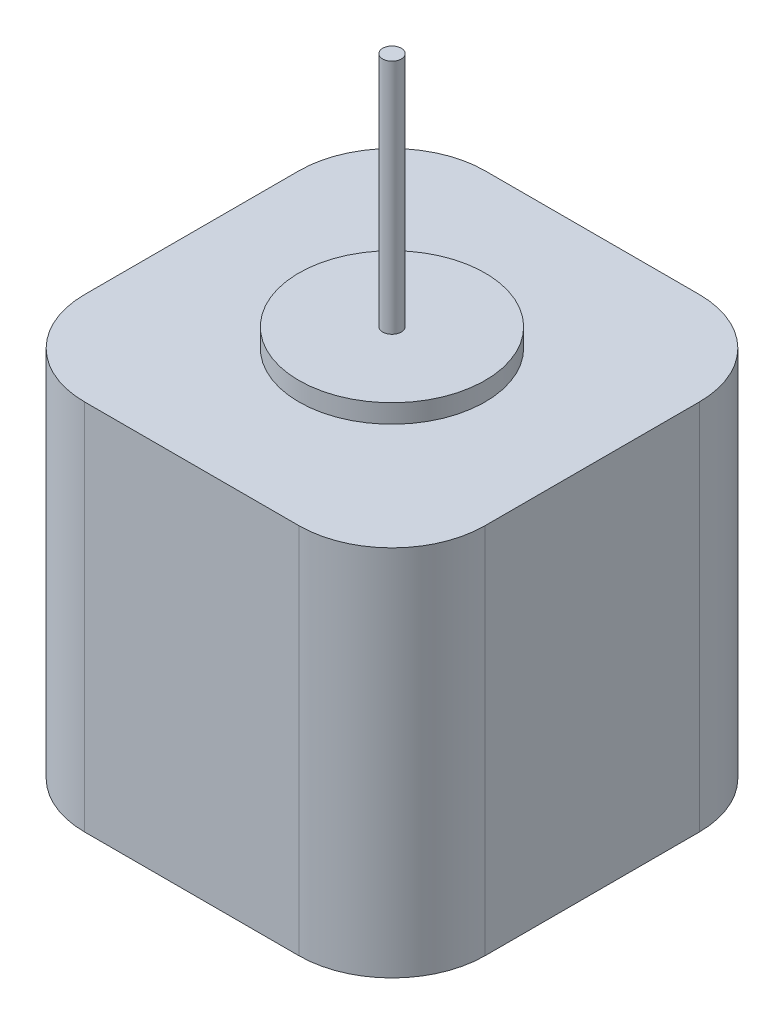
from build123d import *

# Parameters (mm, degrees)
BOSS_EXTRUDE1_DEPTH = 40
SKETCH2_R           = 10
BOSS_EXTRUDE2_DEPTH = 2
SKETCH3_R           = 1
BOSS_EXTRUDE3_DEPTH = 25.4


with BuildPart() as part:
    # Sketch1 → Boss-Extrude1 (new body)
    with BuildSketch(Plane(origin=(0, 0, 0), x_dir=(1, 0, 0), z_dir=(0, 1, 0))):
        with BuildLine():
            Line((11.5, 21.5), (-11.5, 21.5))
            ThreePointArc((-11.5, 21.5), (-18.571067812, 18.571067812), (-21.5, 11.5))
            Line((-21.5, 11.5), (-21.5, -11.5))
            ThreePointArc((-21.5, -11.5), (-18.571067812, -18.571067812), (-11.5, -21.5))
            Line((-11.5, -21.5), (11.5, -21.5))
            ThreePointArc((11.5, -21.5), (18.571067812, -18.571067812), (21.5, -11.5))
            Line((21.5, -11.5), (21.5, 11.5))
            ThreePointArc((21.5, 11.5), (18.571067812, 18.571067812), (11.5, 21.5))
        make_face()
    extrude(amount=BOSS_EXTRUDE1_DEPTH)

    # Sketch2 → Boss-Extrude2 (add)
    with BuildSketch(Plane(origin=(0, 40, 0), x_dir=(1, 0, 0), z_dir=(0, 1, 0))):
        with Locations(Location((0, 0, 0), (0, 0, 270))):
            Circle(SKETCH2_R)
    extrude(amount=BOSS_EXTRUDE2_DEPTH)

    # Sketch3 → Boss-Extrude3 (add)
    with BuildSketch(Plane(origin=(0, 42, 0), x_dir=(1, 0, 0), z_dir=(0, 1, 0))):
        with Locations(Location((0, 0, 0), (0, 0, 270))):
            Circle(SKETCH3_R)
    extrude(amount=BOSS_EXTRUDE3_DEPTH)


solid = part.part
